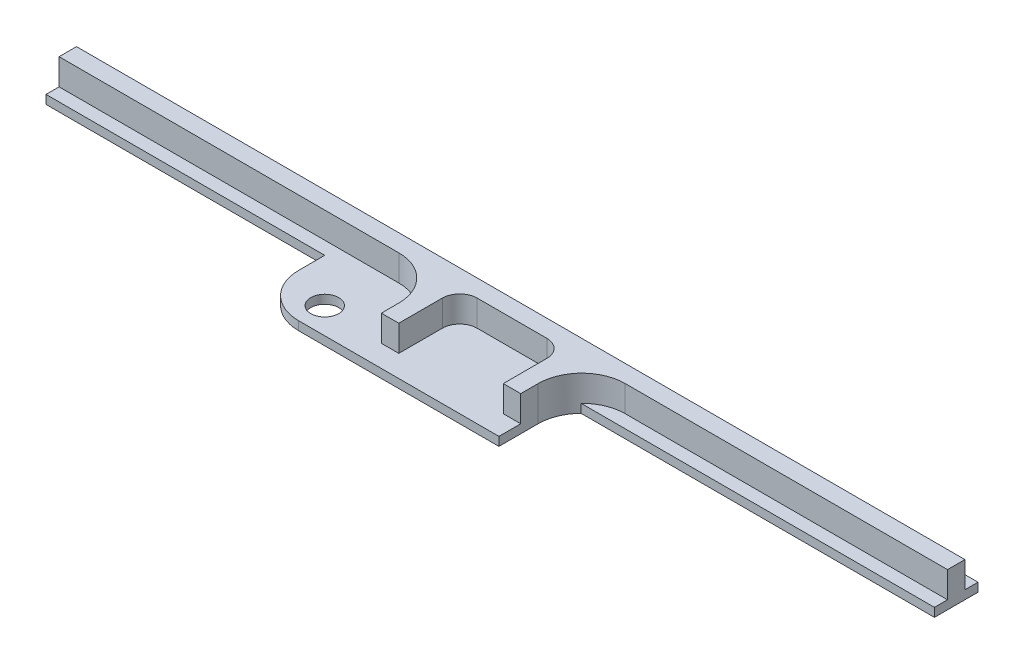
from build123d import *

# Parameters (mm, degrees)
SKETCH_1_R          = 1.6
EXTRUDE_1_DEPTH     = 1
SKETCH_2_W          = 102
SKETCH_2_H          = 2
EXTRUDE_2_DEPTH     = 3
SKETCH_3_W          = 2
SKETCH_3_H          = 7
EXTRUDE_3_DEPTH     = 3
FILLET_1_R          = 5
FILLET_2_R          = 2
CUT_EXTRUDE_1_REACH = 67.833


with BuildPart() as part:
    # 草图1 → 凸台-拉伸1 (new body)
    with BuildSketch(Plane(origin=(0, 0, 0), x_dir=(1, 0, 0), z_dir=(0, 1, 0))):
        Polygon((-37, 10), (-37, 5), (-5, 5), (-5, -3), (35, -3), (35, 5), (65, 5), (65, 10), align=None)
        with Locations(Location((0, 0, 0), (0, 0, 270))):
            Circle(SKETCH_1_R, mode=Mode.SUBTRACT)
        with Locations(Location((30, 0, 0), (0, 0, 270))):
            Circle(SKETCH_1_R, mode=Mode.SUBTRACT)
    extrude(amount=EXTRUDE_1_DEPTH)

    # 草图2 → 凸台-拉伸2 (add)
    with BuildSketch(Plane(origin=(0, 1, 0), x_dir=(1, 0, 0), z_dir=(0, 1, 0))):
        with Locations((14, 7.5)):
            Rectangle(SKETCH_2_W, SKETCH_2_H)
    extrude(amount=EXTRUDE_2_DEPTH)

    # 草图3 → 凸台-拉伸3 (add)
    with BuildSketch(Plane(origin=(0, 1, 0), x_dir=(1, 0, 0), z_dir=(0, 1, 0))):
        with Locations((8, 3)):
            Rectangle(SKETCH_3_W, SKETCH_3_H)
        with Locations((22, 3)):
            Rectangle(SKETCH_3_W, SKETCH_3_H)
    extrude(amount=EXTRUDE_3_DEPTH)

    # 圆角1
    fillet_1_edges = [part.edges().sort_by_distance(p)[0] for p in [
        (35, 0.5, 3),
        (-5, 0.5, 3),
        (7, 2.5, -6.5),
        (23, 2.5, -6.5),
    ]]
    fillet(fillet_1_edges, radius=FILLET_1_R)

    # 圆角2
    fillet_2_edges = [part.edges().sort_by_distance(p)[0] for p in [
        (9, 2.5, -6.5),
        (21, 2.5, -6.5),
    ]]
    fillet(fillet_2_edges, radius=FILLET_2_R)

    # 草图4 → 切除-拉伸1 (cut, up to next)
    with BuildSketch(Plane(origin=(0, 1, 0), x_dir=(1, 0, 0), z_dir=(0, 1, 0)), mode=Mode.PRIVATE) as cut_extrude_1_sk1:
        with BuildLine():
            Line((23, -3), (30, -3))
            ThreePointArc((30, -3), (33.535533906, -1.535533906), (35, 2))
            Line((35, 2), (35, 5))
            Line((35, 5), (24.429285786, 5))
            ThreePointArc((24.429285786, 5), (23.371092404, 3.390294809), (23, 1.5))
            Line((23, 1.5), (23, -0.5))
            Line((23, -0.5), (23, -3))
        make_face()
    cut_extrude_1_tool1 = extrude(cut_extrude_1_sk1.sketch, amount=-CUT_EXTRUDE_1_REACH, mode=Mode.PRIVATE) & part.part
    add(cut_extrude_1_tool1.solids().sort_by_distance((28.803609, 1, -1.118494))[0], mode=Mode.SUBTRACT)


solid = part.part
